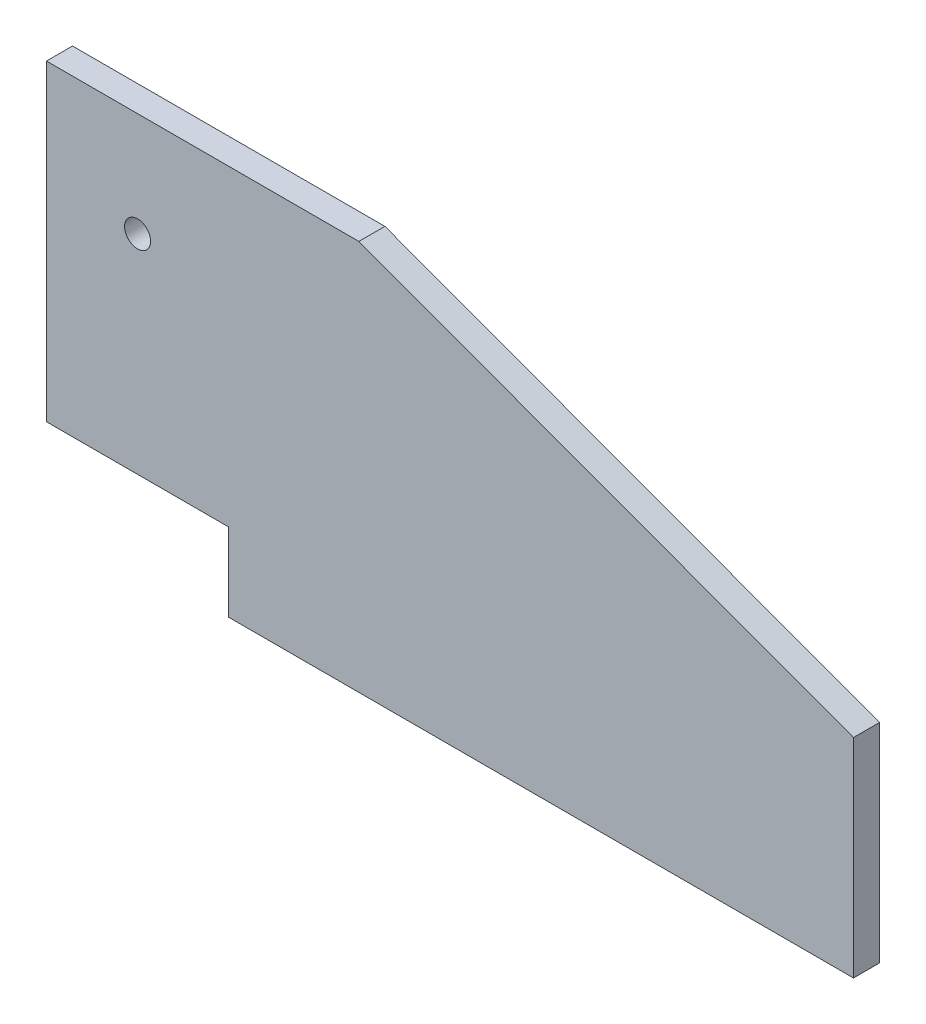
from build123d import *

# Parameters (mm, degrees)
BOSS_EXTRUDE1_DEPTH        = 6.35
F_1_2_0_5_DIAMETER_HOLE1_D = 12.7


with BuildPart() as part:
    # Sketch1 → Boss-Extrude1 (new, symmetric)
    with BuildSketch(Plane.XY):
        Polygon((0, 38.14379681), (-88.9, 38.14379681), (-88.9, 190.54379681), (63.5, 190.54379681), (304.8, 101.6), (304.8, 0), (0, 0), align=None)
    extrude(amount=BOSS_EXTRUDE1_DEPTH, both=True)

    # 1/2 (0.5) Diameter Hole1 (through all)
    with Locations(Plane(origin=(-44.45, 139.74379681, 6.35), x_dir=(1, 0, 0), z_dir=(0, 0, 1))):
        with Locations((0, 0)):
            Hole(F_1_2_0_5_DIAMETER_HOLE1_D / 2)


solid = part.part
